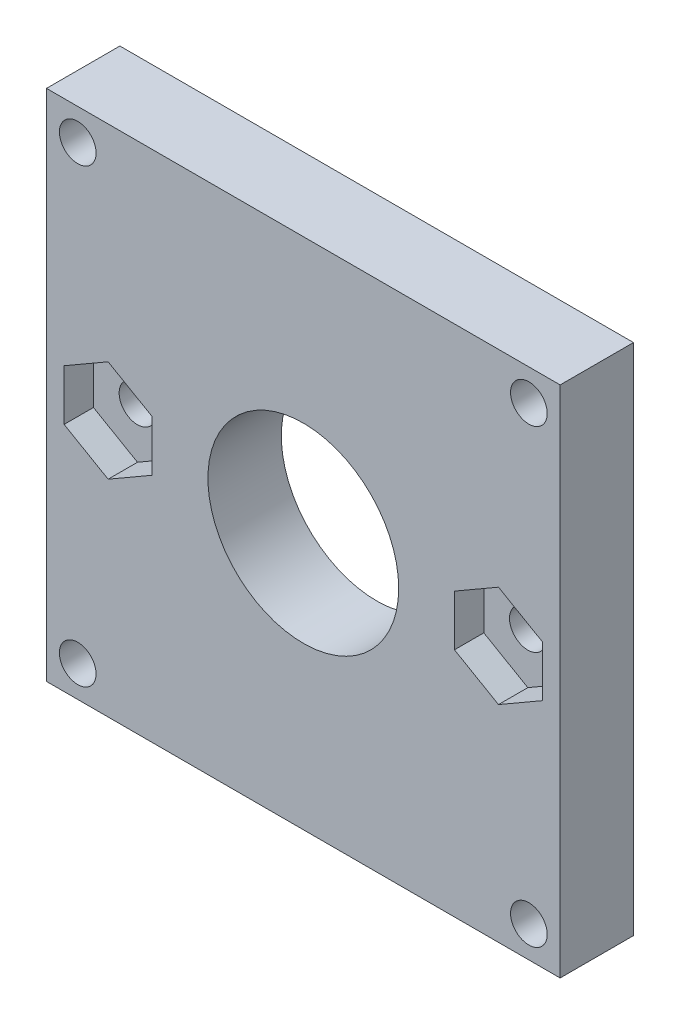
from build123d import *

# Parameters (mm, degrees)
CROQUIS1_W              = 35
CROQUIS1_H              = 35
CROQUIS1_R              = 1.25
CROQUIS1_R_2            = 6.5
SALIENTE_EXTRUIR1_DEPTH = 5
CORTAR_EXTRUIR1_DEPTH   = 2


with BuildPart() as part:
    # Croquis1 → Saliente-Extruir1 (new body)
    with BuildSketch(Plane.XY):
        Rectangle(CROQUIS1_W, CROQUIS1_H)
        with Locations((-15.37, 15.37)):
            Circle(CROQUIS1_R, mode=Mode.SUBTRACT)
        with Locations((15.37, 15.37)):
            Circle(CROQUIS1_R, mode=Mode.SUBTRACT)
        with Locations((15.37, -15.37)):
            Circle(CROQUIS1_R, mode=Mode.SUBTRACT)
        with Locations((-15.37, -15.37)):
            Circle(CROQUIS1_R, mode=Mode.SUBTRACT)
        Circle(CROQUIS1_R_2, mode=Mode.SUBTRACT)
        with Locations((13.3, 0)):
            Circle(CROQUIS1_R, mode=Mode.SUBTRACT)
        with Locations((-13.3, 0)):
            Circle(CROQUIS1_R, mode=Mode.SUBTRACT)
    extrude(amount=SALIENTE_EXTRUIR1_DEPTH)

    # Croquis2 → Cortar-Extruir1 (cut)
    with BuildSketch(Plane.XY.offset(5)):
        Polygon((-13.3, 3.464101615), (-16.3, 1.732050808), (-16.3, -1.732050808), (-13.3, -3.464101615), (-10.3, -1.732050808), (-10.3, 1.732050808), align=None)
        Polygon((13.3, 3.464101615), (10.3, 1.732050808), (10.3, -1.732050808), (13.3, -3.464101615), (16.3, -1.732050808), (16.3, 1.732050808), align=None)
    extrude(amount=-CORTAR_EXTRUIR1_DEPTH, mode=Mode.SUBTRACT)


solid = part.part
